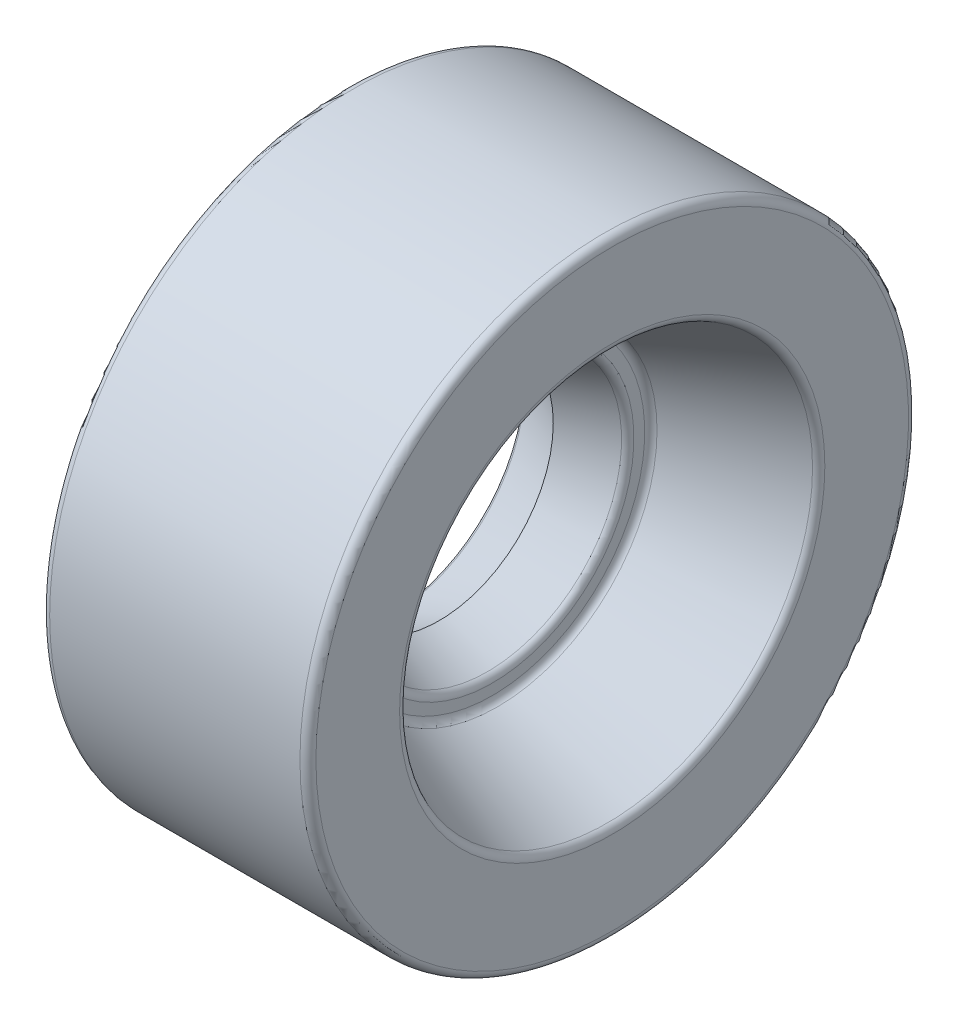
from build123d import *

# Parameters (mm, degrees)
ZAOBLIT1_R = 0.21
SKICA2_R   = 0.525
SKICA2_R_2 = 0.42551639
SKICA2_R_3 = 0.105


with BuildPart() as part:
    # Skica1 → Otočit kolem osy1 (revolve)
    with BuildSketch(Plane.XY, mode=Mode.PRIVATE) as oto_it_kolem_osy1_sk:
        with BuildLine():
            Line((-2.45, 8), (4.55, 8))
            Line((4.55, 8), (4.55, 5.45))
            Line((4.55, 5.45), (1.4, 4.145227279))
            Line((1.4, 4.145227279), (1.4, 3.579898987))
            Line((1.4, 3.579898987), (0, 3))
            Line((0, 3), (-1.4, 3.579898987))
            Line((-1.4, 3.579898987), (-1.4, 4.75))
            Line((-1.4, 4.75), (-0.525, 4.75))
            ThreePointArc((-0.525, 4.75), (0, 4.225), (0.525, 4.75))
            Line((0.525, 4.75), (1.213781171, 4.75))
            Line((1.213781171, 4.75), (3.5, 5.696982846))
            Line((3.5, 5.696982846), (3.5, 6.638173713))
            Line((3.5, 6.638173713), (-2.45, 6.95))
            Line((-2.45, 6.95), (-2.45, 8))
        make_face()
    revolve(oto_it_kolem_osy1_sk.sketch.rotate(Axis((0, 0, 0), (1, 0, 0)), 90), axis=Axis((0, 0, 0), (1, 0, 0)))

    # Zaoblit1
    zaoblit1_edges = [part.edges().sort_by_distance(p)[0] for p in [
        (-1.4, 0, -3.579898987),
        (-1.4, 0, -4.75),
        (1.213781171, 0, -4.75),
        (3.5, 0, -5.696982846),
        (3.5, 0, -6.638173713),
        (-2.45, 0, -6.95),
        (-2.45, 0, -8),
        (4.55, 0, -8),
        (4.55, 0, -5.45),
        (1.4, 0, -4.145227279),
        (1.4, 0, -3.579898987),
    ]]
    fillet(zaoblit1_edges, radius=ZAOBLIT1_R)


with BuildPart() as body_2:
    # Skica2 → Otočit kolem osy3 (revolve)
    # profile 1 of 2: a face of its own
    with BuildSketch(Plane(origin=(0, 0, 0), x_dir=(1, 0, 0), z_dir=(0, 1, 0))):
        with Locations((0, 4.75)):
            Circle(SKICA2_R)
        with Locations((0, 4.75)):
            Circle(SKICA2_R_2, mode=Mode.SUBTRACT)
    # profile 2 of 2: a face of its own
    with BuildSketch(Plane(origin=(0, 0, 0), x_dir=(1, 0, 0), z_dir=(0, 1, 0))):
        with Locations((0, 4.75)):
            Circle(SKICA2_R_3)
    revolve(axis=Axis((0, 0, 0), (1, 0, 0)))


solid = Compound([part.part, body_2.part])
